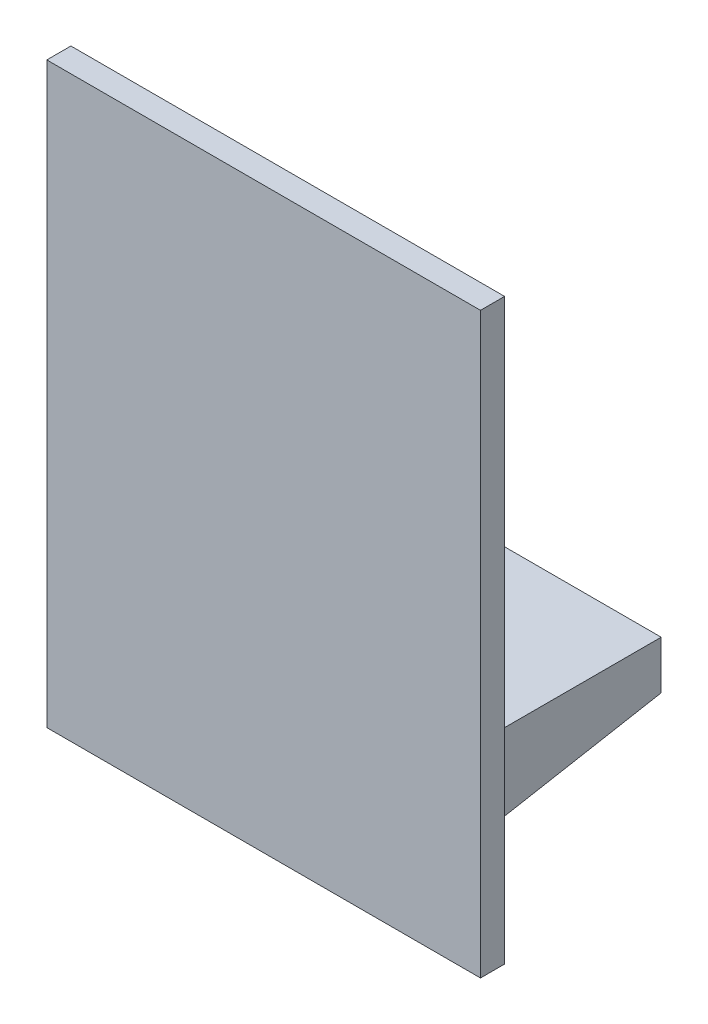
from build123d import *

# Parameters (mm, degrees)
ESBO_O1_W                     = 45
ESBO_O1_H                     = 10
RESSALTO_EXTRUS_O1_DEPTH      = 55
RESSALTO_EXTRUS_O2_DEPTH      = 100
RESSALTO_EXTRUS_O2_DEPTH_BACK = 20
ESBO_O2_W                     = 90
ESBO_O2_H                     = 5
RESSALTO_EXTRUS_O3_DEPTH      = 5
FILETE1_R                     = 20
ESBO_O6_R                     = 1.5
CORTE_EXTRUS_O1_DEPTH         = 10


with BuildPart() as part:
    # Esboço1 → Ressalto-extrusão1 (new body)
    with BuildSketch(Plane.XY):
        Rectangle(ESBO_O1_W, ESBO_O1_H)
    extrude(amount=RESSALTO_EXTRUS_O1_DEPTH)

    # Esboço2 → Ressalto-extrusão2 (add, two sides: drawn at the far end of the back side and taken through both)
    with BuildSketch(Plane(origin=(0, 5, 0), x_dir=(1, 0, 0), z_dir=(0, 1, 0)).offset(-RESSALTO_EXTRUS_O2_DEPTH_BACK)):
        with Locations((0, -57.5)):
            Rectangle(ESBO_O2_W, ESBO_O2_H)
    extrude(amount=RESSALTO_EXTRUS_O2_DEPTH + RESSALTO_EXTRUS_O2_DEPTH_BACK)

    # Esboço5 → Ressalto-extrusão3 (add)
    with BuildSketch(Plane(origin=(22.5, 0, 0), x_dir=(0, 0, -1), z_dir=(1, 0, 0))):
        Polygon((-55, -5), (0, -5), (-55, -15), align=None)
    ressalto_extrus_o3 = extrude(amount=-RESSALTO_EXTRUS_O3_DEPTH)

    # Espelhar1: Ressalto-extrusão3 across plane
    add(ressalto_extrus_o3.mirror(Plane(origin=(0, 0, 0), x_dir=(0, 0, 1), z_dir=(1, 0, 0))))

    # Filete1
    filete1_edges = [part.edges().sort_by_distance(p)[0] for p in [
        (-22.5, -5, 55),
        (22.5, -5, 55),
        (0, 5, 55),
    ]]
    fillet(filete1_edges, radius=FILETE1_R)

    # Esboço6 → Corte-extrusão1 (cut)
    with BuildSketch(Plane(origin=(0, 0, 0), x_dir=(-1, 0, 0), z_dir=(0, 0, -1))):
        with Locations((-17.673330857, 0)):
            Circle(ESBO_O6_R)
        with Locations((17.326669143, 0)):
            Circle(ESBO_O6_R)
    extrude(amount=-CORTE_EXTRUS_O1_DEPTH, mode=Mode.SUBTRACT)


solid = part.part
